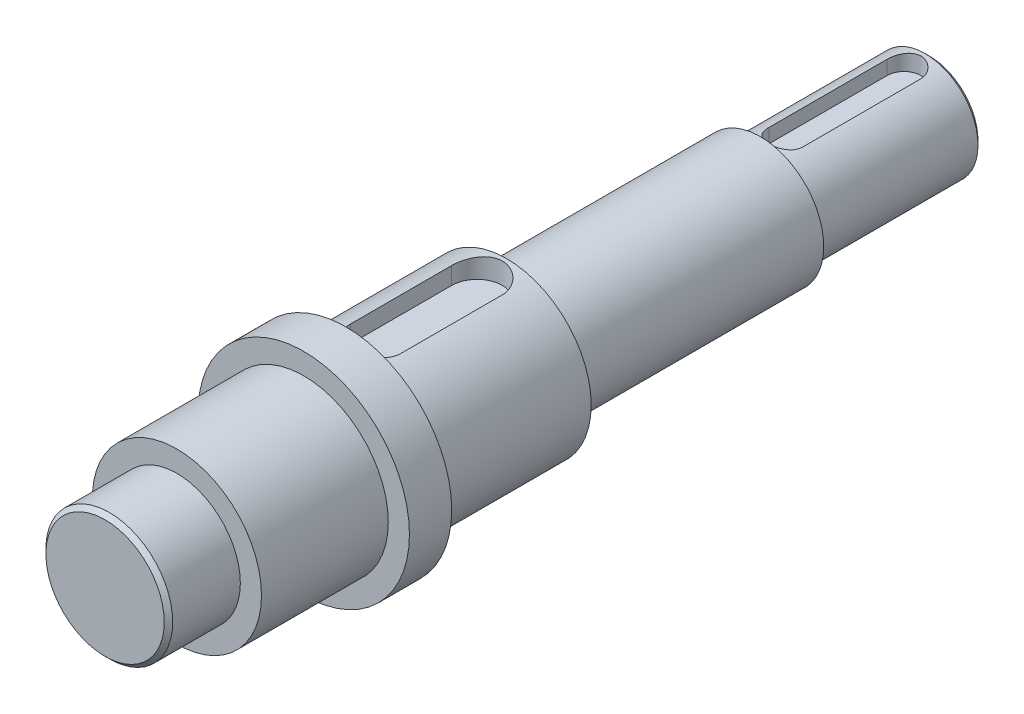
from build123d import *

# Parameters (mm, degrees)
SKETCH_1_R          = 12.5
EXTRUDE_1_DEPTH     = 40
SKETCH_2_R          = 15
EXTRUDE_2_DEPTH     = 60
SKETCH_3_R          = 20
EXTRUDE_3_DEPTH     = 38
SKETCH_4_R          = 25
EXTRUDE_4_DEPTH     = 10
SKETCH_5_R          = 20
EXTRUDE_5_DEPTH     = 30
SKETCH_6_R          = 15
EXTRUDE_6_DEPTH     = 17
CHAMFER_1_SIZE      = 1
CHAMFER_2_SIZE      = 1
CUT_EXTRUDE_1_DEPTH = 24
CUT_EXTRUDE_2_DEPTH = 14


with BuildPart() as part:
    # 草图1 → 凸台-拉伸1 (new body)
    with BuildSketch(Plane.XY):
        Circle(SKETCH_1_R)
    extrude(amount=EXTRUDE_1_DEPTH)

    # 草图2 → 凸台-拉伸2 (add)
    with BuildSketch(Plane.XY.offset(40)):
        Circle(SKETCH_2_R)
    extrude(amount=EXTRUDE_2_DEPTH)

    # 草图3 → 凸台-拉伸3 (add)
    with BuildSketch(Plane.XY.offset(100)):
        Circle(SKETCH_3_R)
    extrude(amount=EXTRUDE_3_DEPTH)

    # 草图4 → 凸台-拉伸4 (add)
    with BuildSketch(Plane.XY.offset(138)):
        Circle(SKETCH_4_R)
    extrude(amount=EXTRUDE_4_DEPTH)

    # 草图5 → 凸台-拉伸5 (add)
    with BuildSketch(Plane.XY.offset(148)):
        Circle(SKETCH_5_R)
    extrude(amount=EXTRUDE_5_DEPTH)

    # 草图6 → 凸台-拉伸6 (add)
    with BuildSketch(Plane.XY.offset(178)):
        Circle(SKETCH_6_R)
    extrude(amount=EXTRUDE_6_DEPTH)

    # 倒角1
    chamfer_1_edges = [part.edges().sort_by_distance(p)[0] for p in [
        (-15, 0, 195),
    ]]
    chamfer(chamfer_1_edges, length=CHAMFER_1_SIZE)

    # 倒角2
    chamfer_2_edges = [part.edges().sort_by_distance(p)[0] for p in [
        (-12.5, 0, 0),
    ]]
    chamfer(chamfer_2_edges, length=CHAMFER_2_SIZE)

    # 草图7 → 切除-拉伸1 (cut)
    with BuildSketch(Plane(origin=(0, 15, 0), x_dir=(1, 0, 0), z_dir=(0, 1, 0))):
        with BuildLine():
            Line((-6, -131), (-6, -107))
            ThreePointArc((-6, -107), (0, -101), (6, -107))
            Line((6, -107), (6, -131))
            ThreePointArc((6, -131), (0, -137), (-6, -131))
        make_face()
    extrude(amount=CUT_EXTRUDE_1_DEPTH, mode=Mode.SUBTRACT)

    # 草图8 → 切除-拉伸2 (cut)
    with BuildSketch(Plane(origin=(0, 8.5, 0), x_dir=(1, 0, 0), z_dir=(0, 1, 0))):
        with BuildLine():
            Line((-4, -6), (-4, -34))
            ThreePointArc((-4, -34), (0, -38), (4, -34))
            Line((4, -34), (4, -6))
            ThreePointArc((4, -6), (0, -2), (-4, -6))
        make_face()
    extrude(amount=CUT_EXTRUDE_2_DEPTH, mode=Mode.SUBTRACT)


solid = part.part
